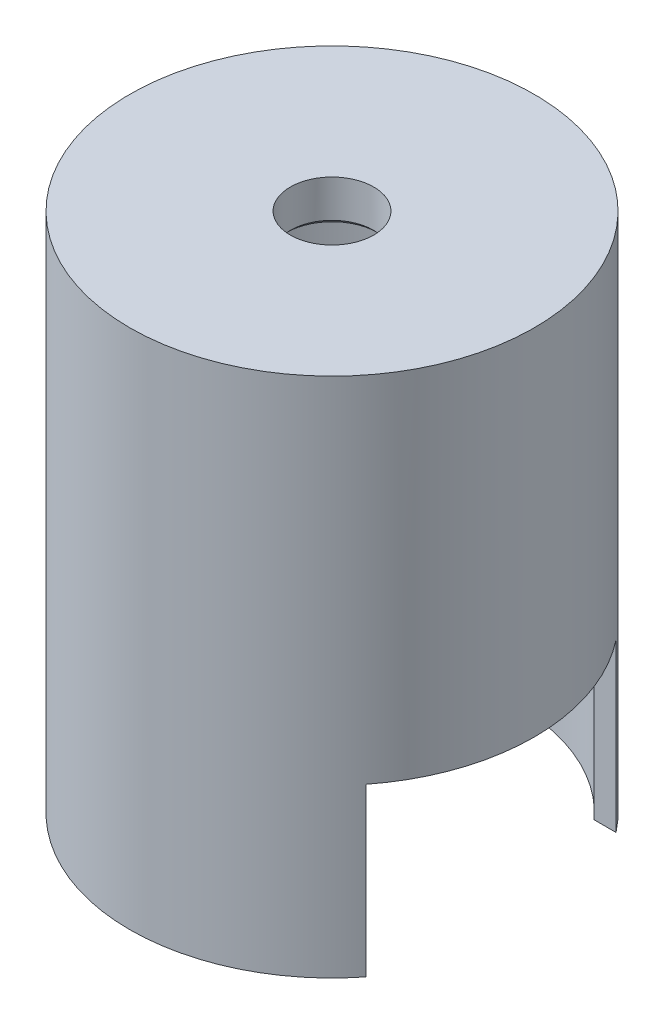
from build123d import *

# Parameters (mm, degrees)
SKETCH_1_R               = 9.7
EXTRUDE_1_DEPTH          = 25
SKETCH_5_R               = 8.9
CUT_EXTRUDE_2_DEPTH      = 23
CUT_EXTRUDE_3_DEPTH      = 29.516311122
CUT_EXTRUDE_3_DEPTH_BACK = 29.516311122
SKETCH_6_W               = 12
SKETCH_6_H               = 16
SKETCH_9_R               = 2
CUT_EXTRUDE_4_DEPTH      = 29.516311122
CHAMFER_5_SIZE           = 0.2


with BuildPart() as part:
    # 草图1 → 凸台-拉伸1 (new body)
    with BuildSketch(Plane(origin=(0, 0, 0), x_dir=(1, 0, 0), z_dir=(0, 1, 0))):
        Circle(SKETCH_1_R)
    extrude(amount=EXTRUDE_1_DEPTH)

    # 草图5 → 切除-拉伸2 (cut)
    with BuildSketch(Plane.XZ):
        Circle(SKETCH_5_R)
    extrude(amount=-CUT_EXTRUDE_2_DEPTH, mode=Mode.SUBTRACT)

    # 草图6 → 切除-拉伸3 (cut, two sides: drawn at the far end of the back side and taken through both)
    with BuildSketch(Plane(origin=(0, 0, 0), x_dir=(0, 0, -1), z_dir=(1, 0, 0)).offset(-CUT_EXTRUDE_3_DEPTH_BACK)):
        Rectangle(SKETCH_6_W, SKETCH_6_H)
    extrude(amount=CUT_EXTRUDE_3_DEPTH + CUT_EXTRUDE_3_DEPTH_BACK, mode=Mode.SUBTRACT)

    # 草图9 → 切除-拉伸4 (cut, through all)
    with BuildSketch(Plane(origin=(0, 25, 0), x_dir=(1, 0, 0), z_dir=(0, 1, 0))):
        Circle(SKETCH_9_R)
    extrude(amount=-CUT_EXTRUDE_4_DEPTH, mode=Mode.SUBTRACT)

    # 倒角5
    chamfer_5_edges = [part.edges().sort_by_distance(p)[0] for p in [
        (-2, 23, 0),
    ]]
    chamfer(chamfer_5_edges, length=CHAMFER_5_SIZE)


solid = part.part
